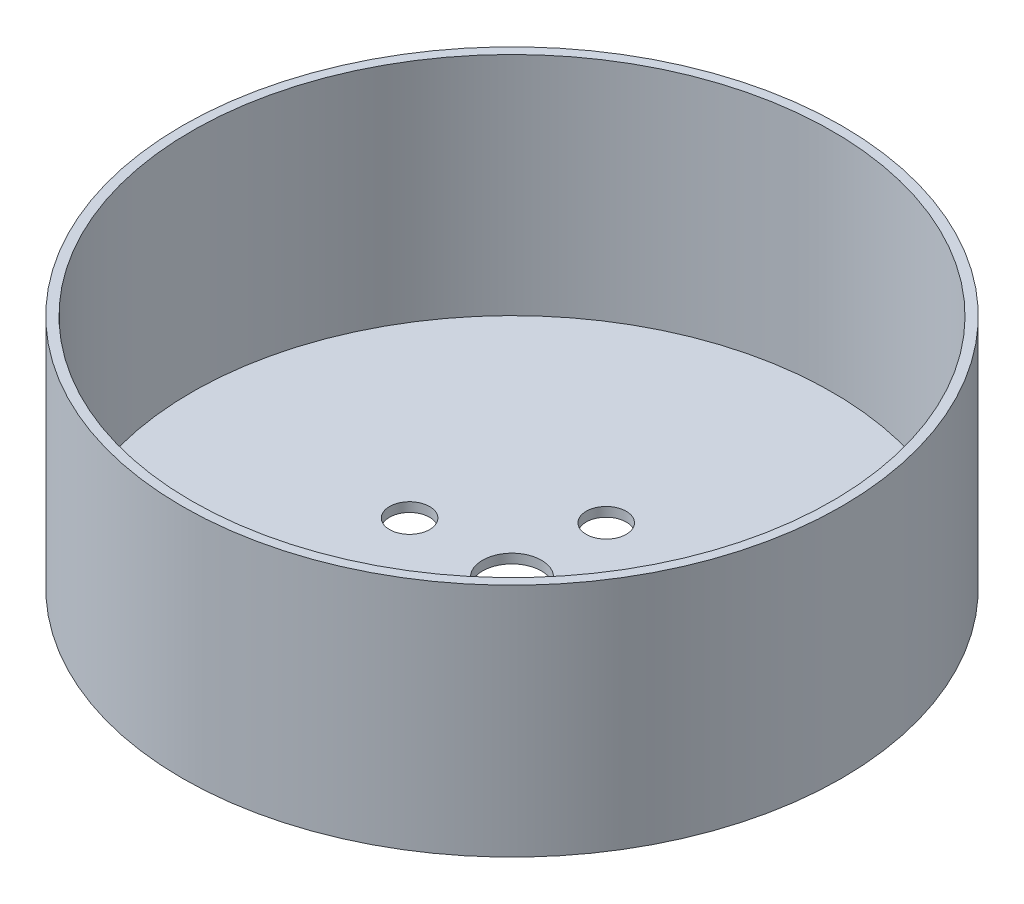
from build123d import *

# Parameters (mm, degrees)
SKETCH1_R            = 28
BOSS_EXTRUDE1_DEPTH  = 20
SKETCH2_R            = 27.20625
CUT_EXTRUDE1_DEPTH   = 19.20625
M3_CLEARANCE_HOLE1_D = 3.4
SKETCH5_R            = 2.5
CUT_EXTRUDE2_DEPTH   = 45.362146026


with BuildPart() as part:
    # Sketch1 → Boss-Extrude1 (new body)
    with BuildSketch(Plane(origin=(0, 0, 0), x_dir=(1, 0, 0), z_dir=(0, 1, 0))):
        with Locations(Location((0, 0, 0), (0, 0, 270))):
            Circle(SKETCH1_R)
    extrude(amount=BOSS_EXTRUDE1_DEPTH)

    # Sketch2 → Cut-Extrude1 (cut)
    with BuildSketch(Plane(origin=(0, 20, 0), x_dir=(1, 0, 0), z_dir=(0, 1, 0))):
        with Locations(Location((0, 0, 0), (0, 0, 270))):
            Circle(SKETCH2_R)
    extrude(amount=-CUT_EXTRUDE1_DEPTH, mode=Mode.SUBTRACT)

    # M3 Clearance Hole1 (through all)
    with Locations(Plane(origin=(0, 0, 0), x_dir=(-1, 0, 0), z_dir=(0, -1, 0))):
        with Locations((0, 8), (0, -8), (-8.700000126, 0), (8.700000126, 0)):
            Hole(M3_CLEARANCE_HOLE1_D / 2)

    # Sketch5 → Cut-Extrude2 (cut, through all)
    with BuildSketch(Plane.XZ):
        with Locations(Location((0, 0, 0), (0, 0, 270))):
            Circle(SKETCH5_R)
    extrude(amount=-CUT_EXTRUDE2_DEPTH, mode=Mode.SUBTRACT)


solid = part.part
